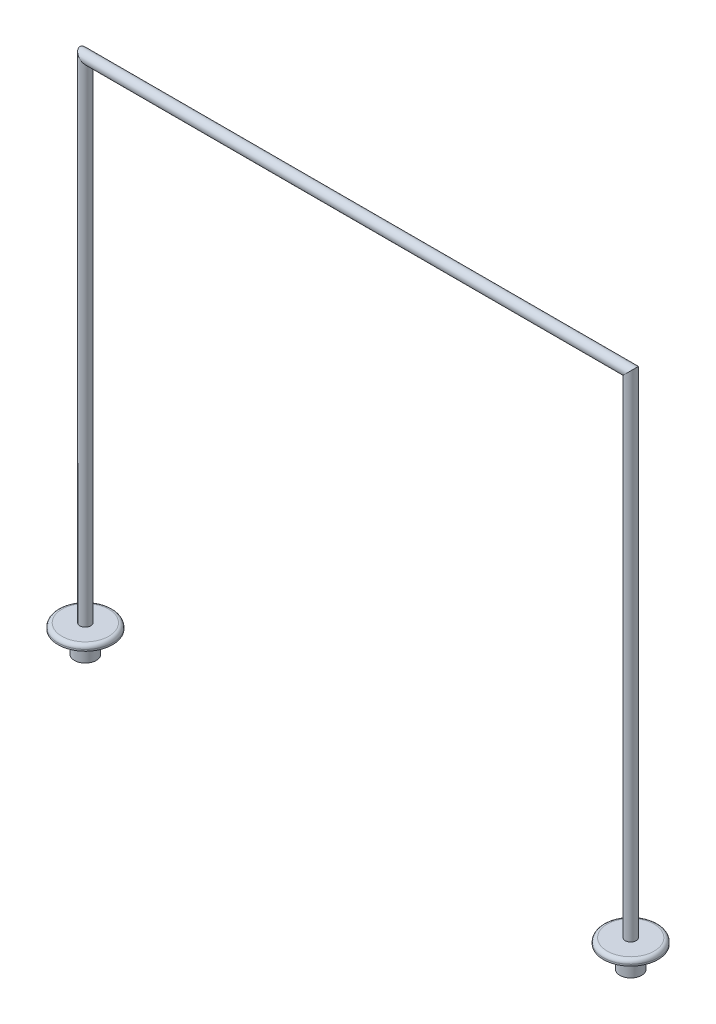
from build123d import *

# Parameters (mm, degrees)
SKETCH5_R = 1
SKETCH4_W = 4
SKETCH4_H = 2


with BuildPart() as part:
    # Sweep1: sweep along a path in Sketch3
    with BuildLine(Plane.XY) as sweep1_path:
        Line((0, 0), (0, 90))
        Line((0, 90), (100, 90))
        Line((100, 90), (100, 0))
    # Sketch5 → Sweep1 (sweep)
    with BuildSketch(Plane(origin=(0, 0, 0), x_dir=(1, 0, 0), z_dir=(0, 1, 0))):
        Circle(SKETCH5_R)
    sweep(path=sweep1_path.line, transition=Transition.RIGHT)

    # Sketch4 → Revolve1 (revolve)
    with BuildSketch(Plane.YZ):
        with BuildLine():
            Line((0, -4.3), (0, 0))
            Line((0, 0), (-1, 0))
            Line((-1, 0), (-1, -2))
            Line((-1, -2), (-1, -5))
            Line((-1, -5), (-0.7, -5))
            ThreePointArc((-0.7, -5), (-0.205025253, -4.794974747), (0, -4.3))
        make_face()
        with Locations((-3, -1)):
            Rectangle(SKETCH4_W, SKETCH4_H)
    revolve1 = revolve(axis=Axis((0, 0, 0), (0, 1, 0)))

    # Mirror1: Revolve1 across plane
    add(revolve1.mirror(Plane(origin=(50, 0, 0), x_dir=(0, 0, 1), z_dir=(1, 0, 0))))


solid = part.part
